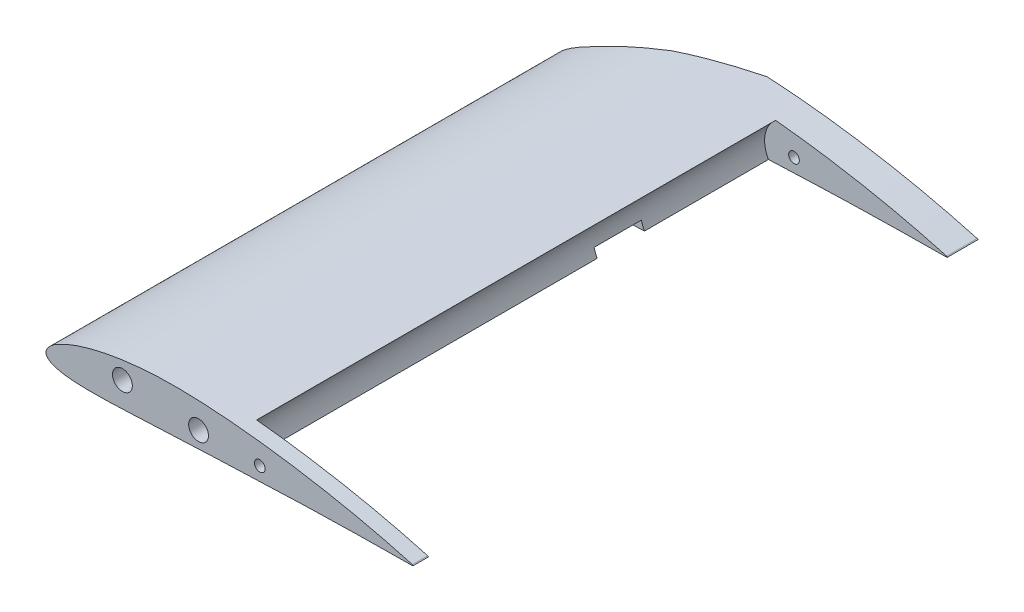
from build123d import *

# Parameters (mm, degrees)
EXTRUDE_1_DEPTH          = 185
SKETCH_2_R               = 3.25
CUT_EXTRUDE_1_DEPTH      = 221.978766148
CUT_EXTRUDE_2_DEPTH      = 221.978766148
CUT_EXTRUDE_2_DEPTH_BACK = 221.978766148
SKETCH_3_W               = 50
SKETCH_3_H               = 170
SKETCH_5_R               = 1.75
CUT_EXTRUDE_3_DEPTH      = 221.978766196
CUT_EXTRUDE_START        = -10
SKETCH_6_R               = 9.629939138
CUT_EXTRUDE_4_DEPTH      = 170
CUT_EXTRUDE_5_DEPTH      = 1
CUT_EXTRUDE_5_DEPTH_BACK = 221.978766196


with BuildPart() as part:
    # 草圖4 → 填料-伸長1 (new body)
    with BuildSketch(Plane.XY):
        with BuildLine():
            add(Edge.make_bspline(
                [(120, 0.156), (120.550064826, 0), (120, -0.156)],
                knots=[0, 0, 0, 1, 1, 1], degree=2))
            add(Edge.make_bspline(
                [(120, 0.156), (118.002062038, 0.699883829), (114.015827899, 1.785026774), (106.030245524, 3.758084328), (96.043999536, 5.938072944), (84.032443886, 8.087020219), (72.030199863, 9.848487706), (60.021268297, 11.104941512), (48.013383082, 11.888579605), (37.989056271, 11.896504921), (29.98519837, 11.342771412), (23.974194566, 10.613404695), (17.950199351, 9.537800408), (12.958326827, 8.244233687), (8.958076554, 6.937785184), (5.941795374, 5.704437414), (3.368139922, 4.370604372), (1.134204878, 2.77510484), (-0.810450078, 0.209036715), (1.28854905, -1.753439419), (3.430370135, -2.523784281), (5.981131747, -3.043733145), (8.993574888, -3.308089705), (12.998336856, -3.495180047), (18.001252309, -3.481166853), (24.002604177, -3.313228981), (29.999721531, -2.993463999), (37.999752898, -2.619308415), (47.998084378, -2.139166009), (60.000346089, -1.688308544), (71.998752124, -1.187669763), (83.99830623, -0.761253895), (95.998821653, -0.44759827), (105.999699706, -0.288346287), (113.999817607, -0.183470629), (117.999975201, -0.165156712), (120, -0.156)],
                knots=[0, 0, 0, 0, 0.025304886, 0.050487653, 0.100520433, 0.150190716, 0.199586607, 0.248740009, 0.297715539, 0.346600594, 0.371102737, 0.395726297, 0.420570145, 0.445825119, 0.458702216, 0.471919982, 0.485786003, 0.493461051, 0.506863029, 0.51614777, 0.522766003, 0.535269014, 0.547551134, 0.559786371, 0.584228898, 0.60868081, 0.633151284, 0.657621757, 0.706558114, 0.75548187, 0.804405627, 0.853320224, 0.902221408, 0.951113136, 0.975557228, 1, 1, 1, 1], degree=3))
        make_face()
    extrude(amount=EXTRUDE_1_DEPTH)

    # 草圖2 → 除料-伸長1 (cut, through all)
    with BuildSketch(Plane(origin=(0, 0, 0), x_dir=(-1, 0, 0), z_dir=(0, 0, -1))):
        with Locations((-25, 5)):
            Circle(SKETCH_2_R)
        with Locations((-49.939101256, 3.256088156)):
            Circle(SKETCH_2_R)
    extrude(amount=-CUT_EXTRUDE_1_DEPTH, mode=Mode.SUBTRACT)

    # 草圖3 → 除料-伸長2 (cut, two sides: drawn at the far end of the back side and taken through both)
    with BuildSketch(Plane(origin=(0, 0, 0), x_dir=(1, 0, 0), z_dir=(0, 1, 0)).offset(-CUT_EXTRUDE_2_DEPTH_BACK)):
        with Locations((95.275032413, -95)):
            Rectangle(SKETCH_3_W, SKETCH_3_H)
        Polygon((51.110434759, 0), (27.636259388, -7.640861389), (9.885539584, -15.378354637), (-0.033686903, -18.232170833), (-0.033686903, 0), align=None)
    extrude(amount=CUT_EXTRUDE_2_DEPTH + CUT_EXTRUDE_2_DEPTH_BACK, mode=Mode.SUBTRACT)

    # 草圖5 → 除料-伸長3 (cut, through all)
    with BuildSketch(Plane(origin=(0, 0, 0), x_dir=(-1, 0, 0), z_dir=(0, 0, -1))):
        with Locations((-70, 3.156)):
            Circle(SKETCH_5_R)
    extrude(amount=-CUT_EXTRUDE_3_DEPTH, mode=Mode.SUBTRACT)

    # 草圖6 → 除料-伸長4 (cut)
    with BuildSketch(Plane(origin=(0, 0, 0), x_dir=(-1, 0, 0), z_dir=(0, 0, -1)).offset(CUT_EXTRUDE_START)):
        with Locations((-70, 3.156)):
            Circle(SKETCH_6_R)
    extrude(amount=-CUT_EXTRUDE_4_DEPTH, mode=Mode.SUBTRACT)

    # 草圖7 → 除料-伸長5 (cut, two sides: drawn at the far end of the back side and taken through both)
    with BuildSketch(Plane(origin=(0, 0, 0), x_dir=(1, 0, 0), z_dir=(0, 1, 0)).offset(-CUT_EXTRUDE_5_DEPTH_BACK)):
        Polygon((17.634868009, -50.615833774), (17.634868009, -25), (51.634868009, -25), (51.634868009, -50.615833774), (82.521973888, -50.615833774), (82.521973888, -66.086141402), (8.412581614, -66.086141402), (8.412581614, -50.615833774), align=None)
    extrude(amount=CUT_EXTRUDE_5_DEPTH + CUT_EXTRUDE_5_DEPTH_BACK, mode=Mode.SUBTRACT)


solid = part.part
